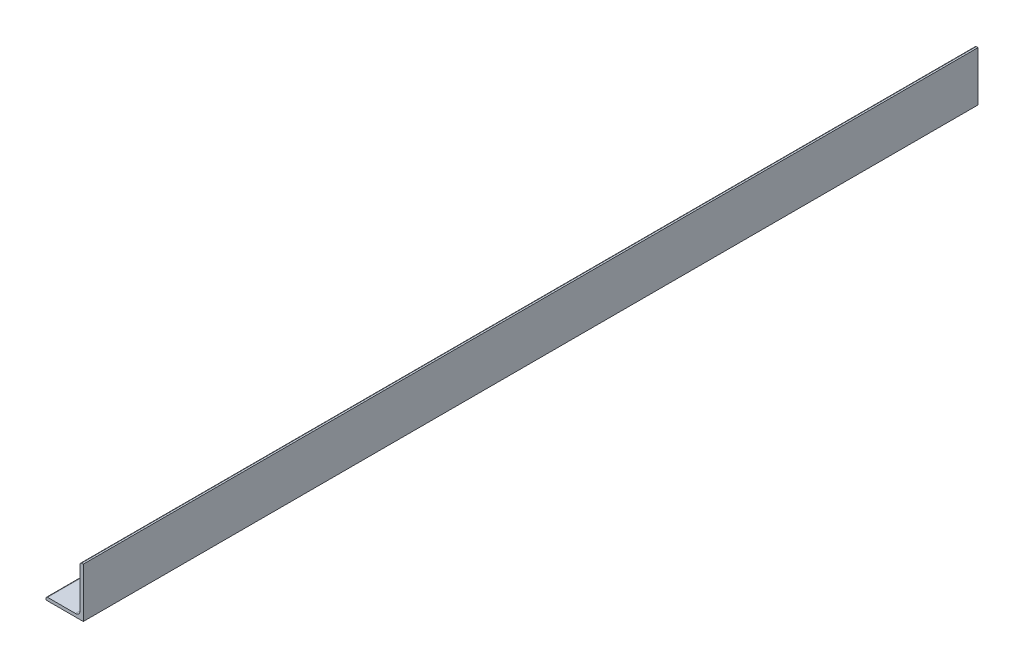
from build123d import *

# Parameters (mm, degrees)
BOSS_EXTRUDE1_DEPTH = 457.2


with BuildPart() as part:
    # Sketch2 → Boss-Extrude1 (new, symmetric)
    with BuildSketch(Plane.XY):
        with BuildLine():
            Line((-19.05, -25.4), (19.05, -25.4))
            Line((19.05, -25.4), (19.05, 25.4))
            Line((19.05, 25.4), (17.4625, 25.4))
            ThreePointArc((17.4625, 25.4), (16.339967985, 24.935032015), (15.875, 23.8125))
            Line((15.875, 23.8125), (15.875, -17.4498))
            ThreePointArc((15.875, -17.4498), (14.476376302, -20.826376302), (11.0998, -22.225))
            Line((11.0998, -22.225), (-17.4625, -22.225))
            ThreePointArc((-17.4625, -22.225), (-18.585032015, -22.689967985), (-19.05, -23.8125))
            Line((-19.05, -23.8125), (-19.05, -25.4))
        make_face()
    extrude(amount=BOSS_EXTRUDE1_DEPTH, both=True)


solid = part.part
